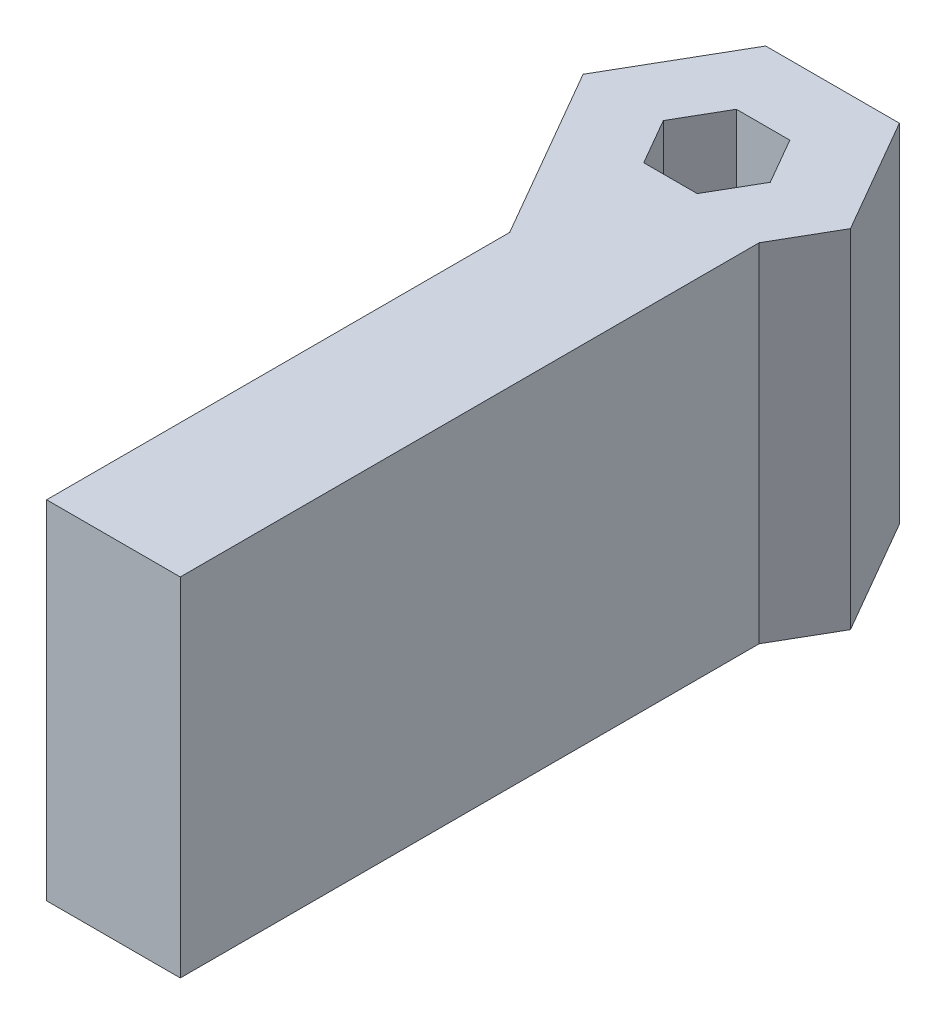
from build123d import *

# Parameters (mm, degrees)
BOSS_EXTRUDE1_DEPTH = 15


with BuildPart() as part:
    # Sketch1 → Boss-Extrude1 (new body)
    with BuildSketch(Plane(origin=(0, 0, 0), x_dir=(1, 0, 0), z_dir=(0, 1, 0))):
        Polygon((-1.443375673, -7.5), (-1.443375673, -27.5), (4.330127019, -27.5), (4.330127019, -2.5), (5.773502692, 0), (2.886751346, 5), (-2.886751346, 5), (-5.773502692, 0), align=None)
        Polygon((2.309401077, 0), (1.154700538, 2), (-1.154700538, 2), (-2.309401077, 0), (-1.154700538, -2), (1.154700538, -2), align=None, mode=Mode.SUBTRACT)
    extrude(amount=BOSS_EXTRUDE1_DEPTH)


solid = part.part
